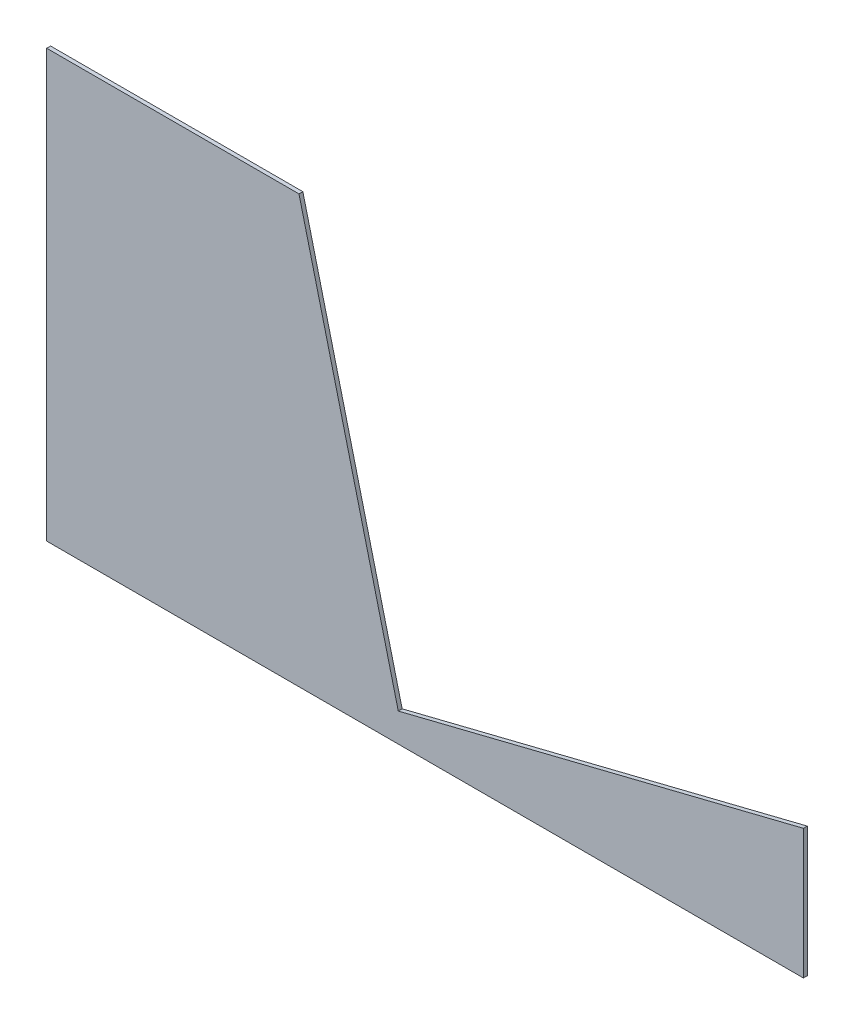
from build123d import *

# Parameters (mm, degrees)
BOSS_EXTRUDE1_DEPTH = 1


with BuildPart() as part:
    # Sketch1 → Boss-Extrude1 (new body)
    with BuildSketch(Plane.XY):
        Polygon((150, -340), (215.008607966, -340), (240.59540403, -442.623033803), (345, -416.592044402), (345, -450), (150, -450), align=None)
    extrude(amount=BOSS_EXTRUDE1_DEPTH)


solid = part.part
